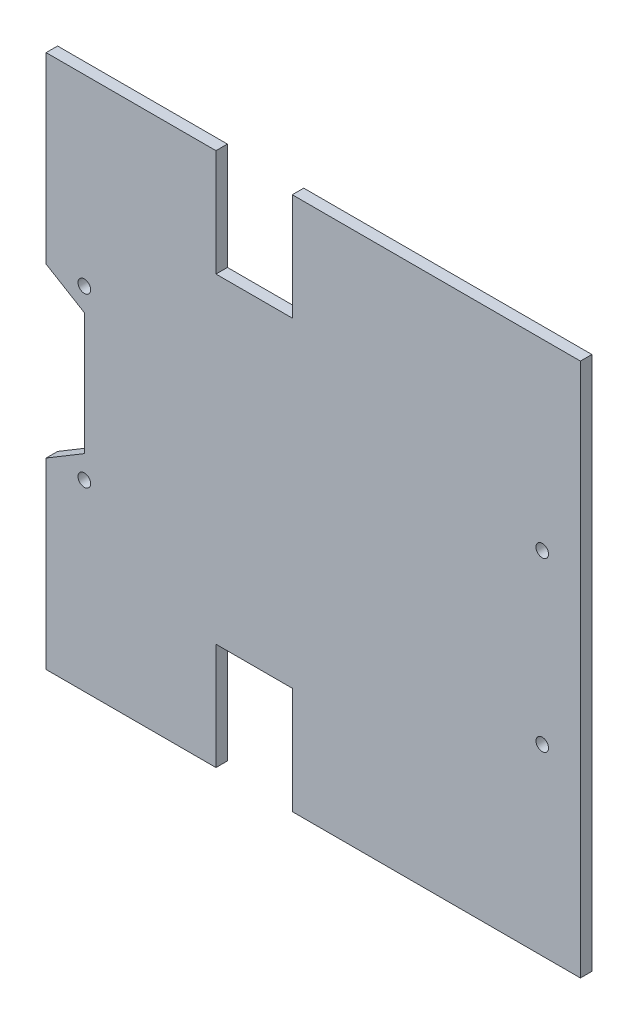
from build123d import *

# Parameters (mm, degrees)
SKETCH1_R           = 1.65
BOSS_EXTRUDE1_DEPTH = 3


with BuildPart() as part:
    # Sketch1 → Boss-Extrude1 (new body)
    with BuildSketch(Plane.XY):
        Polygon((0, -26), (44.5, -26), (44.5, 2), (64.5, 2), (64.5, -26), (140, -26), (140, 22), (140, 66), (140, 114), (64.5, 114), (64.5, 86), (44.5, 86), (44.5, 114), (0, 114), (0, 66), (10, 60), (10, 28), (0, 22), align=None)
        with Locations((10, 22)):
            Circle(SKETCH1_R, mode=Mode.SUBTRACT)
        with Locations(Location((130, 66, 0), (0, 0, 180))):
            Circle(SKETCH1_R, mode=Mode.SUBTRACT)
        with Locations((130, 22)):
            Circle(SKETCH1_R, mode=Mode.SUBTRACT)
        with Locations(Location((10, 66, 0), (0, 0, 180))):
            Circle(SKETCH1_R, mode=Mode.SUBTRACT)
    extrude(amount=BOSS_EXTRUDE1_DEPTH)


solid = part.part
